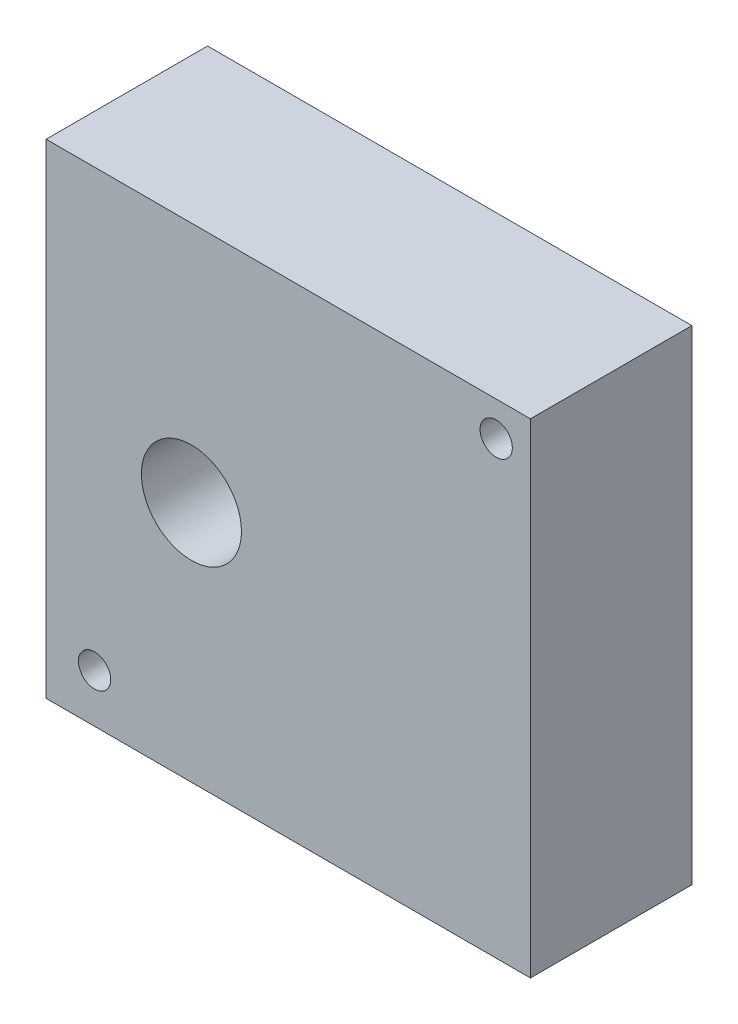
from build123d import *

# Parameters (mm, degrees)
SKETCH1_W             = 30
SKETCH1_H             = 30
BOSS_EXTRUDE1_DEPTH   = 10
SKETCH2_W             = 30
SKETCH2_H             = 30
SKETCH2_W_2           = 20
SKETCH2_H_2           = 20
BOSS_EXTRUDE2_DEPTH   = 10
SKETCH2_W_3           = 5
SKETCH2_H_3           = 3.748828889
BOSS_EXTRUDE2_2_DEPTH = 10
BOSS_EXTRUDE2_3_DEPTH = 10
SKETCH3_W             = 30
SKETCH3_H             = 30
BOSS_EXTRUDE3_DEPTH   = 10
SKETCH4_R             = 3.1
CUT_EXTRUDE1_DEPTH    = 10
SKETCH5_R             = 3.1
CUT_EXTRUDE2_DEPTH    = 10
CUT_EXTRUDE3_START    = -30
SKETCH8_R             = 1
CUT_EXTRUDE3_DEPTH    = 30


with BuildPart() as part:
    # Sketch1 → Boss-Extrude1 (new body)
    with BuildSketch(Plane.XY):
        Rectangle(SKETCH1_W, SKETCH1_H)
    extrude(amount=BOSS_EXTRUDE1_DEPTH)

    # Sketch5 → Cut-Extrude2 (cut)
    with BuildSketch(Plane(origin=(0, 0, 0), x_dir=(-1, 0, 0), z_dir=(0, 0, -1))):
        with Locations((-6, -0.372899474)):
            Circle(SKETCH5_R)
    extrude(amount=-CUT_EXTRUDE2_DEPTH, mode=Mode.SUBTRACT)


with BuildPart() as body_2:
    # Sketch2 → Boss-Extrude2 (new body)
    with BuildSketch(Plane.XY.offset(10)):
        Rectangle(SKETCH2_W, SKETCH2_H)
        Rectangle(SKETCH2_W_2, SKETCH2_H_2, mode=Mode.SUBTRACT)
    extrude(amount=BOSS_EXTRUDE2_DEPTH)


with BuildPart() as body_3:
    # Sketch2 → Boss-Extrude2 2 (new body)
    with BuildSketch(Plane.XY.offset(10)):
        with Locations((0, 5.374414445)):
            Rectangle(SKETCH2_W_3, SKETCH2_H_3)
    extrude(amount=BOSS_EXTRUDE2_2_DEPTH)


with BuildPart() as body_4:
    # Sketch2 → Boss-Extrude2 3 (new body)
    with BuildSketch(Plane.XY.offset(10)):
        with Locations((0, -5.374414445)):
            Rectangle(SKETCH2_W_3, SKETCH2_H_3)
    extrude(amount=BOSS_EXTRUDE2_3_DEPTH)


with BuildPart() as body_5:
    # Sketch3 → Boss-Extrude3 (new body)
    with BuildSketch(Plane.XY.offset(20)):
        Rectangle(SKETCH3_W, SKETCH3_H)
    extrude(amount=BOSS_EXTRUDE3_DEPTH)

    # Sketch4 → Cut-Extrude1 (cut)
    with BuildSketch(Plane.XY.offset(30)):
        with Locations((-6, 0)):
            Circle(SKETCH4_R)
    extrude(amount=-CUT_EXTRUDE1_DEPTH, mode=Mode.SUBTRACT)


with BuildPart() as cut_extrude3_tool:
    # Sketch8 → Cut-Extrude3 (new body)
    with BuildSketch(Plane.XY.offset(30).offset(CUT_EXTRUDE3_START)):
        with Locations((-12, -12)):
            Circle(SKETCH8_R)
        with Locations((12.878679656, 12.878679656)):
            Circle(SKETCH8_R)
    extrude(amount=CUT_EXTRUDE3_DEPTH)


with BuildPart() as part_1:
    add(part.part)

    # Cut-Extrude3: cut by cut_extrude3_tool
    add(cut_extrude3_tool.part, mode=Mode.SUBTRACT)


with BuildPart() as body_2_1:
    add(body_2.part)

    # Cut-Extrude3: cut by cut_extrude3_tool
    add(cut_extrude3_tool.part, mode=Mode.SUBTRACT)


with BuildPart() as body_5_1:
    add(body_5.part)

    # Cut-Extrude3: cut by cut_extrude3_tool
    add(cut_extrude3_tool.part, mode=Mode.SUBTRACT)


solid = body_5_1.part
